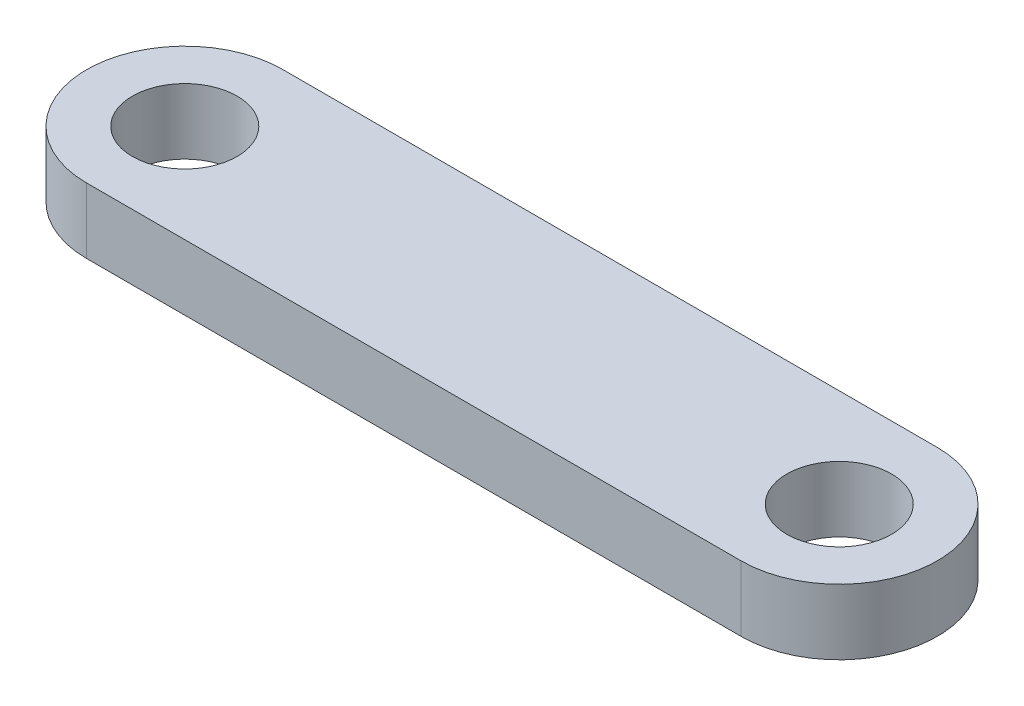
from build123d import *

# Parameters (mm, degrees)
SKETCH_1_R      = 4
EXTRUDE_1_DEPTH = 5


with BuildPart() as part:
    # 草图1 → 凸台-拉伸1 (new body)
    with BuildSketch(Plane(origin=(0, 0, 0), x_dir=(1, 0, 0), z_dir=(0, 1, 0))):
        with BuildLine():
            Line((-25, 7.5), (25, 7.5))
            ThreePointArc((25, 7.5), (32.5, 0), (25, -7.5))
            Line((25, -7.5), (-25, -7.5))
            ThreePointArc((-25, -7.5), (-32.5, 0), (-25, 7.5))
        make_face()
        with Locations(Location((-25, 0, 0), (0, 0, 270))):
            Circle(SKETCH_1_R, mode=Mode.SUBTRACT)
        with Locations(Location((25, 0, 0), (0, 0, 270))):
            Circle(SKETCH_1_R, mode=Mode.SUBTRACT)
    extrude(amount=EXTRUDE_1_DEPTH)


solid = part.part
